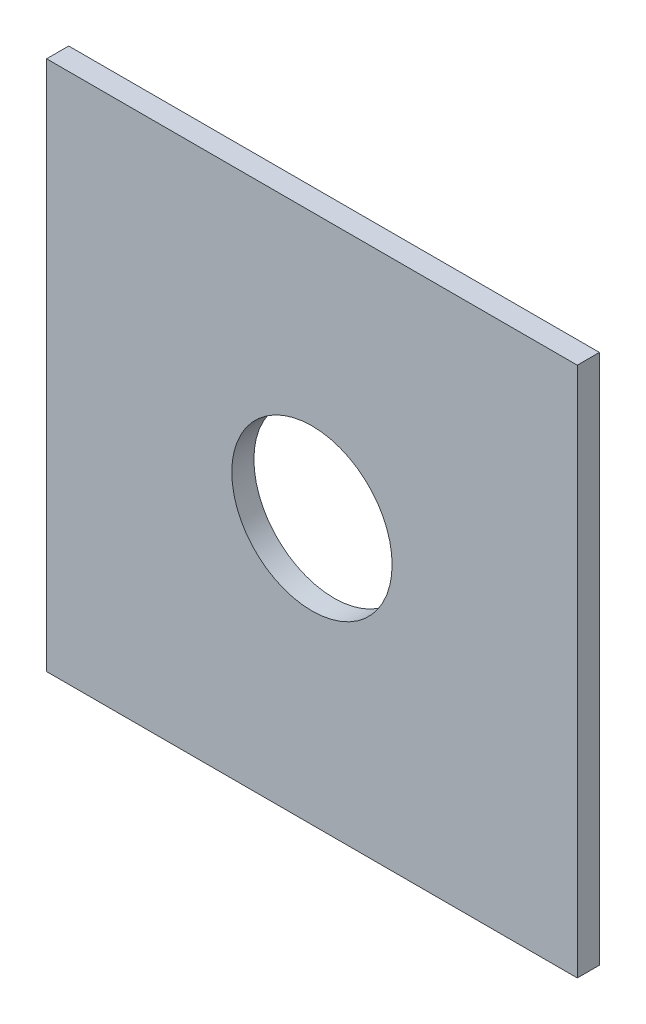
from build123d import *

# Parameters (mm, degrees)
SKETCH1_W           = 304.8
SKETCH1_H           = 304.8
SKETCH1_R           = 46.0375
BOSS_EXTRUDE1_DEPTH = 12.7
SKETCH2_R           = 7.9375
CUT_EXTRUDE1_DEPTH  = 9.525


with BuildPart() as part:
    # Sketch1 → Boss-Extrude1 (new body)
    with BuildSketch(Plane.XY):
        Rectangle(SKETCH1_W, SKETCH1_H)
        Circle(SKETCH1_R, mode=Mode.SUBTRACT)
    extrude(amount=BOSS_EXTRUDE1_DEPTH)

    # Sketch2 → Cut-Extrude1 (cut)
    with BuildSketch(Plane.XY):
        with Locations(Location((-71.842048969, 71.842048969, 0), (0, 0, 180))):
            Circle(SKETCH2_R)
        with Locations(Location((71.842048969, -71.842048969, 0), (0, 0, 180))):
            Circle(SKETCH2_R)
    extrude(amount=CUT_EXTRUDE1_DEPTH, mode=Mode.SUBTRACT)


solid = part.part
